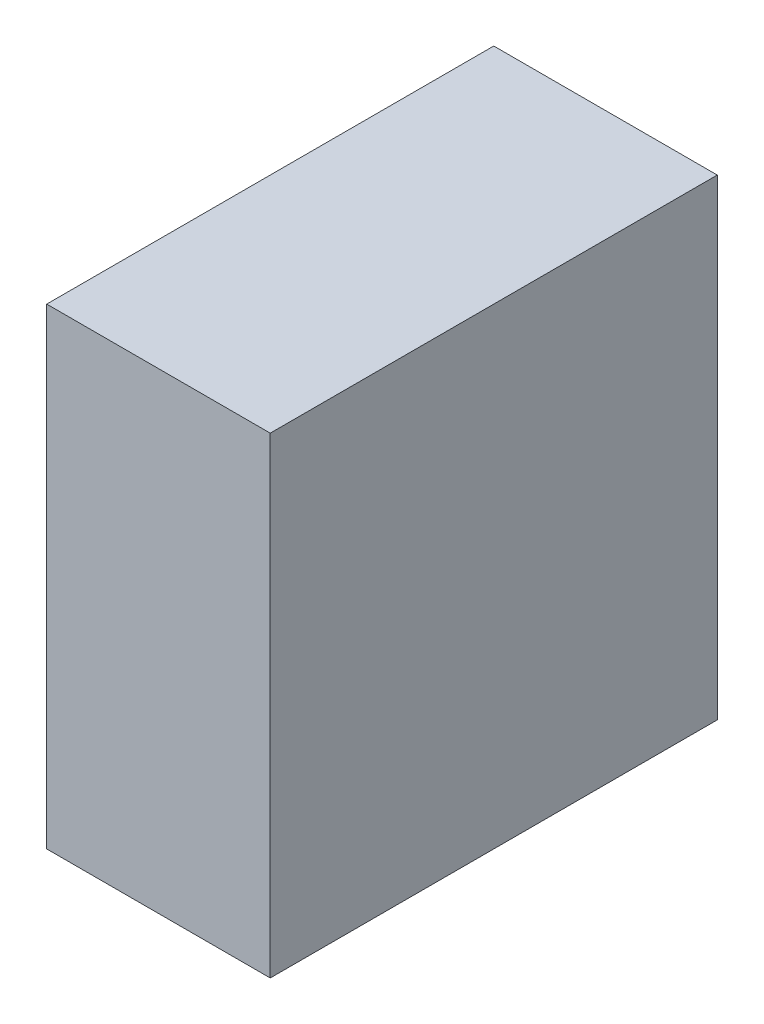
from build123d import *

# Parameters (mm, degrees)
SKETCH1_W           = 57.15
SKETCH1_H           = 120.65
BOSS_EXTRUDE1_DEPTH = 57.15


with BuildPart() as part:
    # Sketch1 → Boss-Extrude1 (new, symmetric)
    with BuildSketch(Plane.XY):
        with Locations((0, 60.325)):
            Rectangle(SKETCH1_W, SKETCH1_H)
    extrude(amount=BOSS_EXTRUDE1_DEPTH, both=True)


solid = part.part
